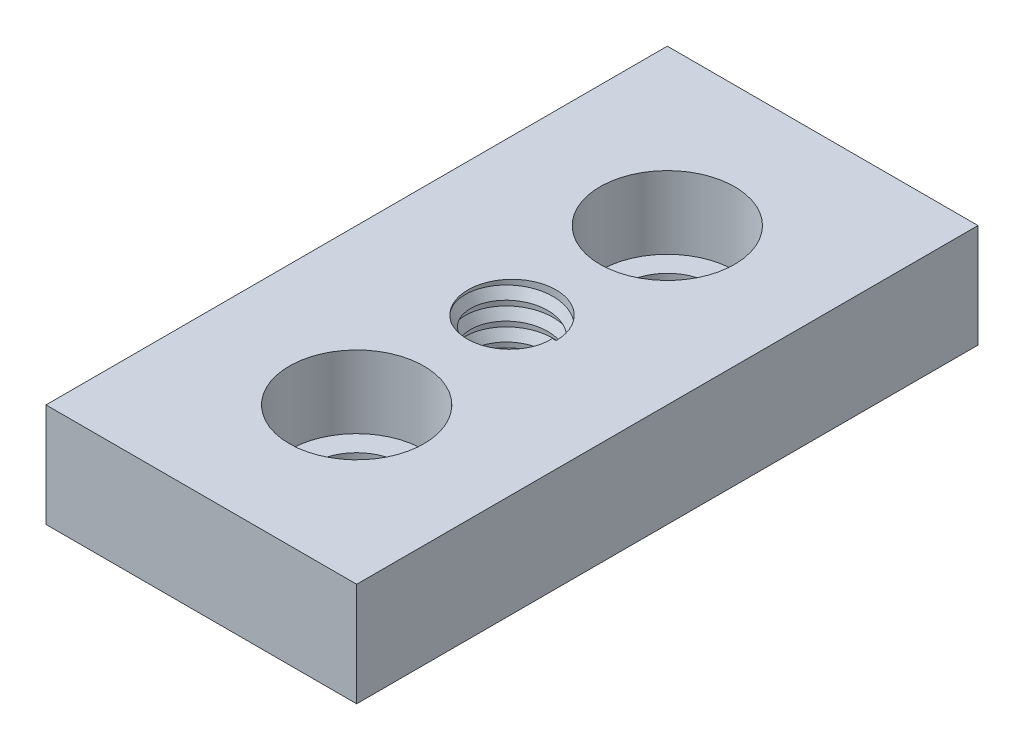
from build123d import *

# Parameters (mm, degrees)
SKETCH_1_W          = 30
SKETCH_1_H          = 60
SKETCH_1_R          = 4.25
EXTRUDE_1_DEPTH     = 10
SKETCH_3_R          = 6.5
CUT_EXTRUDE_1_DEPTH = 7
SWEEP_1_PITCH       = 1.75
SWEEP_1_HEIGHT      = 10
SWEEP_1_RADIUS      = 4.25
SWEEP_1_START_ANGLE = 90
SKETCH_6_W          = 30
SKETCH_6_H          = 9.258755221
SKETCH_6_H_2        = 12.64673583
CUT_EXTRUDE_2_DEPTH = 63.748440843


with BuildPart() as part:
    # 草图1 → 凸台-拉伸1 (new body)
    with BuildSketch(Plane(origin=(0, 0, 0), x_dir=(1, 0, 0), z_dir=(0, 1, 0))):
        Rectangle(SKETCH_1_W, SKETCH_1_H)
        with Locations(Location((0, 15, 0), (0, 0, 270))):
            Circle(SKETCH_1_R, mode=Mode.SUBTRACT)
        with Locations(Location((0, -15, 0), (0, 0, 270))):
            Circle(SKETCH_1_R, mode=Mode.SUBTRACT)
        with Locations(Location((0, 0, 0), (0, 0, 270))):
            Circle(SKETCH_1_R, mode=Mode.SUBTRACT)
    extrude(amount=EXTRUDE_1_DEPTH)

    # 草图3 → 切除-拉伸1 (cut)
    with BuildSketch(Plane(origin=(0, 10, 0), x_dir=(1, 0, 0), z_dir=(0, 1, 0))):
        with Locations(Location((0, 15, 0), (0, 0, 270))):
            Circle(SKETCH_3_R)
        with Locations(Location((0, -15, 0), (0, 0, 270))):
            Circle(SKETCH_3_R)
    extrude(amount=-CUT_EXTRUDE_1_DEPTH, mode=Mode.SUBTRACT)

    # 扫描1: sweep along a helix
    with BuildLine() as sweep_1_path:
        add(Helix(SWEEP_1_PITCH, SWEEP_1_HEIGHT, SWEEP_1_RADIUS, center=(0, 10, 0), direction=(0, -1, 0), mode=Mode.PRIVATE).rotate(Axis((0, 10, 0), (0, -1, 0)), SWEEP_1_START_ANGLE))
    # 草图5 → 扫描1 (sweep)
    with BuildSketch(Plane(origin=(4.25, 10, 0), x_dir=(1, 0, 0), z_dir=(3.1170229136343766e-15, -0.06539411290163802, 0.9978595141590864))):
        Polygon((0, 0.601609008), (-0.521008684, -0.300804504), (0.521008684, -0.300804504), align=None)
    sweep(path=sweep_1_path.line, is_frenet=True)

    # 草图6 → 切除-拉伸2 (cut, through all)
    with BuildSketch(Plane.XY.offset(30)):
        with Locations((0, 14.629377611)):
            Rectangle(SKETCH_6_W, SKETCH_6_H)
        with Locations((0, -6.323367915)):
            Rectangle(SKETCH_6_W, SKETCH_6_H_2)
    extrude(amount=-CUT_EXTRUDE_2_DEPTH, mode=Mode.SUBTRACT)


solid = part.part
